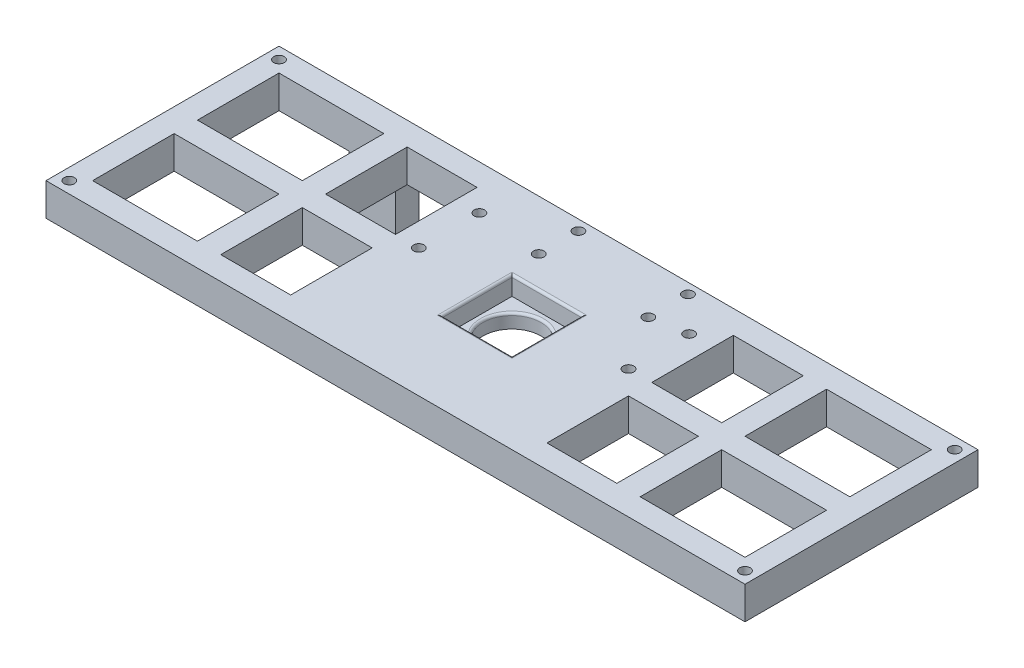
from build123d import *

# Parameters (mm, degrees)
SKETCH_1_W           = 300
SKETCH_1_H           = 100
EXTRUDE_1_DEPTH      = 16
SKETCH_2_W           = 30
SKETCH_2_H           = 30
CUT_EXTRUDE_1_DEPTH  = 8
SKETCH_3_R           = 12.5
CUT_EXTRUDE_2_DEPTH  = 14
CUT_EXTRUDE_3_REACH  = 318.632
SKETCH_4_W           = 50
SKETCH_4_H           = 35
SKETCH_7_W           = 35
SKETCH_7_H           = 16
EXTRUDE_2_DEPTH      = 20
SKETCH_8_W           = 35
SKETCH_8_H           = 16
EXTRUDE_3_DEPTH      = 20
SKETCH_9_W           = 20
SKETCH_9_H           = 10
EXTRUDE_4_DEPTH      = 25
FILLET_1_R           = 1
FILLET_2_R           = 1
SKETCH_13_W          = 35
SKETCH_13_H          = 16
EXTRUDE_6_DEPTH      = 4
SKETCH_14_W          = 35
SKETCH_14_H          = 16
EXTRUDE_7_DEPTH      = 4
SKETCH_17_W          = 35
SKETCH_17_H          = 16
EXTRUDE_8_DEPTH      = 1
SKETCH_18_W          = 35
SKETCH_18_H          = 16
EXTRUDE_9_DEPTH      = 1
SKETCH_19_R          = 2.25
CUT_EXTRUDE_8_DEPTH  = 5
CUT_EXTRUDE_START    = -7
SKETCH_20_R          = 2.25
CUT_EXTRUDE_9_DEPTH  = 7
CUT_EXTRUDE_15_DEPTH = 2
SKETCH_28_R          = 2.25
CUT_EXTRUDE_18_DEPTH = 5
SKETCH_30_R          = 1.5
CUT_EXTRUDE_20_DEPTH = 4


with BuildPart() as part:
    # 草图1 → 凸台-拉伸1 (new body)
    with BuildSketch(Plane(origin=(0, 0, 0), x_dir=(1, 0, 0), z_dir=(0, 1, 0))):
        with Locations((-150, 50)):
            Rectangle(SKETCH_1_W, SKETCH_1_H)
    extrude(amount=EXTRUDE_1_DEPTH)

    # 草图2 → 切除-拉伸1 (cut)
    with BuildSketch(Plane(origin=(0, 16, 0), x_dir=(1, 0, 0), z_dir=(0, 1, 0))):
        with Locations((-150, 50)):
            Rectangle(SKETCH_2_W, SKETCH_2_H)
    extrude(amount=-CUT_EXTRUDE_1_DEPTH, mode=Mode.SUBTRACT)

    # 草图3 → 切除-拉伸2 (cut)
    with BuildSketch(Plane(origin=(0, 8, 0), x_dir=(1, 0, 0), z_dir=(0, 1, 0))):
        with Locations(Location((-150, 50, 0), (0, 0, 270))):
            Circle(SKETCH_3_R)
    extrude(amount=-CUT_EXTRUDE_2_DEPTH, mode=Mode.SUBTRACT)

    # 草图4 → 切除-拉伸3 (cut, up to next)
    with BuildSketch(Plane(origin=(0, 16, 0), x_dir=(1, 0, 0), z_dir=(0, 1, 0)), mode=Mode.PRIVATE) as cut_extrude_3_sk1:
        with Locations((-270, 72.5)):
            Rectangle(SKETCH_4_W, SKETCH_4_H)
    cut_extrude_3_tool1 = extrude(cut_extrude_3_sk1.sketch, amount=-CUT_EXTRUDE_3_REACH, mode=Mode.PRIVATE) & part.part
    # 草图4 → 切除-拉伸3 (cut, up to next)
    with BuildSketch(Plane(origin=(0, 16, 0), x_dir=(1, 0, 0), z_dir=(0, 1, 0)), mode=Mode.PRIVATE) as cut_extrude_3_sk2:
        with Locations((-270, 27.5)):
            Rectangle(SKETCH_4_W, SKETCH_4_H)
    cut_extrude_3_tool2 = extrude(cut_extrude_3_sk2.sketch, amount=-CUT_EXTRUDE_3_REACH, mode=Mode.PRIVATE) & part.part
    # 草图4 → 切除-拉伸3 (cut, up to next)
    with BuildSketch(Plane(origin=(0, 16, 0), x_dir=(1, 0, 0), z_dir=(0, 1, 0)), mode=Mode.PRIVATE) as cut_extrude_3_sk3:
        with Locations((-210, 72.5)):
            Rectangle(SKETCH_4_W, SKETCH_4_H)
    cut_extrude_3_tool3 = extrude(cut_extrude_3_sk3.sketch, amount=-CUT_EXTRUDE_3_REACH, mode=Mode.PRIVATE) & part.part
    # 草图4 → 切除-拉伸3 (cut, up to next)
    with BuildSketch(Plane(origin=(0, 16, 0), x_dir=(1, 0, 0), z_dir=(0, 1, 0)), mode=Mode.PRIVATE) as cut_extrude_3_sk4:
        with Locations((-210, 27.5)):
            Rectangle(SKETCH_4_W, SKETCH_4_H)
    cut_extrude_3_tool4 = extrude(cut_extrude_3_sk4.sketch, amount=-CUT_EXTRUDE_3_REACH, mode=Mode.PRIVATE) & part.part
    # 草图4 → 切除-拉伸3 (cut, up to next)
    with BuildSketch(Plane(origin=(0, 16, 0), x_dir=(1, 0, 0), z_dir=(0, 1, 0)), mode=Mode.PRIVATE) as cut_extrude_3_sk5:
        with Locations((-30, 27.5)):
            Rectangle(SKETCH_4_W, SKETCH_4_H)
    cut_extrude_3_tool5 = extrude(cut_extrude_3_sk5.sketch, amount=-CUT_EXTRUDE_3_REACH, mode=Mode.PRIVATE) & part.part
    # 草图4 → 切除-拉伸3 (cut, up to next)
    with BuildSketch(Plane(origin=(0, 16, 0), x_dir=(1, 0, 0), z_dir=(0, 1, 0)), mode=Mode.PRIVATE) as cut_extrude_3_sk6:
        with Locations((-90, 27.5)):
            Rectangle(SKETCH_4_W, SKETCH_4_H)
    cut_extrude_3_tool6 = extrude(cut_extrude_3_sk6.sketch, amount=-CUT_EXTRUDE_3_REACH, mode=Mode.PRIVATE) & part.part
    # 草图4 → 切除-拉伸3 (cut, up to next)
    with BuildSketch(Plane(origin=(0, 16, 0), x_dir=(1, 0, 0), z_dir=(0, 1, 0)), mode=Mode.PRIVATE) as cut_extrude_3_sk7:
        with Locations((-90, 72.5)):
            Rectangle(SKETCH_4_W, SKETCH_4_H)
    cut_extrude_3_tool7 = extrude(cut_extrude_3_sk7.sketch, amount=-CUT_EXTRUDE_3_REACH, mode=Mode.PRIVATE) & part.part
    # 草图4 → 切除-拉伸3 (cut, up to next)
    with BuildSketch(Plane(origin=(0, 16, 0), x_dir=(1, 0, 0), z_dir=(0, 1, 0)), mode=Mode.PRIVATE) as cut_extrude_3_sk8:
        with Locations((-30, 72.5)):
            Rectangle(SKETCH_4_W, SKETCH_4_H)
    cut_extrude_3_tool8 = extrude(cut_extrude_3_sk8.sketch, amount=-CUT_EXTRUDE_3_REACH, mode=Mode.PRIVATE) & part.part
    add(cut_extrude_3_tool1.solids().sort_by_distance((-270, 16, -72.5))[0], mode=Mode.SUBTRACT)
    add(cut_extrude_3_tool2.solids().sort_by_distance((-270, 16, -27.5))[0], mode=Mode.SUBTRACT)
    add(cut_extrude_3_tool3.solids().sort_by_distance((-210, 16, -72.5))[0], mode=Mode.SUBTRACT)
    add(cut_extrude_3_tool4.solids().sort_by_distance((-210, 16, -27.5))[0], mode=Mode.SUBTRACT)
    add(cut_extrude_3_tool5.solids().sort_by_distance((-30, 16, -27.5))[0], mode=Mode.SUBTRACT)
    add(cut_extrude_3_tool6.solids().sort_by_distance((-90, 16, -27.5))[0], mode=Mode.SUBTRACT)
    add(cut_extrude_3_tool7.solids().sort_by_distance((-90, 16, -72.5))[0], mode=Mode.SUBTRACT)
    add(cut_extrude_3_tool8.solids().sort_by_distance((-30, 16, -72.5))[0], mode=Mode.SUBTRACT)

    # 草图7 → 凸台-拉伸2 (add)
    with BuildSketch(Plane.ZY.offset(185)):
        with Locations((-27.5, 8)):
            Rectangle(SKETCH_7_W, SKETCH_7_H)
        with Locations((-72.5, 8)):
            Rectangle(SKETCH_7_W, SKETCH_7_H)
    extrude(amount=EXTRUDE_2_DEPTH)

    # 草图8 → 凸台-拉伸3 (add)
    with BuildSketch(Plane(origin=(-115, 0, 0), x_dir=(0, 0, -1), z_dir=(1, 0, 0))):
        with Locations((27.5, 8)):
            Rectangle(SKETCH_8_W, SKETCH_8_H)
        with Locations((72.5, 8)):
            Rectangle(SKETCH_8_W, SKETCH_8_H)
    extrude(amount=EXTRUDE_3_DEPTH)

    # 草图9 → 凸台-拉伸4 (add)
    with BuildSketch(Plane.XZ):
        with Locations((-250, -95)):
            Rectangle(SKETCH_9_W, SKETCH_9_H)
    extrude(amount=EXTRUDE_4_DEPTH)

    # 圆角1
    fillet_1_edges = [part.edges().sort_by_distance(p)[0] for p in [
        (-150, 8, -62.5),
    ]]
    fillet(fillet_1_edges, radius=FILLET_1_R)

    # 圆角2
    fillet_2_edges = [part.edges().sort_by_distance(p)[0] for p in [
        (-135, 16, -50),
        (-150, 16, -65),
        (-165, 16, -50),
        (-150, 16, -35),
    ]]
    fillet(fillet_2_edges, radius=FILLET_2_R)

    # 草图13 → 凸台-拉伸6 (add)
    with BuildSketch(Plane.ZY.offset(5)):
        with Locations((-72.5, 8)):
            Rectangle(SKETCH_13_W, SKETCH_13_H)
        with Locations((-27.5, 8)):
            Rectangle(SKETCH_13_W, SKETCH_13_H)
    extrude(amount=EXTRUDE_6_DEPTH)

    # 草图14 → 凸台-拉伸7 (add)
    with BuildSketch(Plane(origin=(-295, 0, 0), x_dir=(0, 0, -1), z_dir=(1, 0, 0))):
        with Locations((72.5, 8)):
            Rectangle(SKETCH_14_W, SKETCH_14_H)
        with Locations((27.5, 8)):
            Rectangle(SKETCH_14_W, SKETCH_14_H)
    extrude(amount=EXTRUDE_7_DEPTH)

    # 草图17 → 凸台-拉伸8 (add)
    with BuildSketch(Plane(origin=(-291, 0, 0), x_dir=(0, 0, -1), z_dir=(1, 0, 0))):
        with Locations((27.5, 8)):
            Rectangle(SKETCH_17_W, SKETCH_17_H)
        with Locations((72.5, 8)):
            Rectangle(SKETCH_17_W, SKETCH_17_H)
    extrude(amount=EXTRUDE_8_DEPTH)

    # 草图18 → 凸台-拉伸9 (add)
    with BuildSketch(Plane.ZY.offset(9)):
        with Locations((-27.5, 8)):
            Rectangle(SKETCH_18_W, SKETCH_18_H)
        with Locations((-72.5, 8)):
            Rectangle(SKETCH_18_W, SKETCH_18_H)
    extrude(amount=EXTRUDE_9_DEPTH)

    # 草图19 → 切除-拉伸8 (cut)
    with BuildSketch(Plane(origin=(0, 16, 0), x_dir=(1, 0, 0), z_dir=(0, 1, 0))):
        with Locations(Location((-295, 95, 0), (0, 0, 270))):
            Circle(SKETCH_19_R)
        with Locations(Location((-295, 5, 0), (0, 0, 90))):
            Circle(SKETCH_19_R)
        with Locations(Location((-5, 5, 0), (0, 0, 270))):
            Circle(SKETCH_19_R)
        with Locations(Location((-5, 95, 0), (0, 0, 90))):
            Circle(SKETCH_19_R)
    extrude(amount=-CUT_EXTRUDE_8_DEPTH, mode=Mode.SUBTRACT)

    # 草图20 → 切除-拉伸9 (cut)
    with BuildSketch(Plane.XZ.offset(CUT_EXTRUDE_START)):
        with Locations(Location((-295, -95, 0), (0, 0, 90))):
            Circle(SKETCH_20_R)
        with Locations(Location((-295, -5, 0), (0, 0, 270))):
            Circle(SKETCH_20_R)
        with Locations(Location((-5, -95, 0), (0, 0, 270))):
            Circle(SKETCH_20_R)
        with Locations(Location((-5, -5, 0), (0, 0, 90))):
            Circle(SKETCH_20_R)
    extrude(amount=CUT_EXTRUDE_9_DEPTH, mode=Mode.SUBTRACT)

    # 草图26 → 切除-拉伸15 (cut)
    with BuildSketch(Plane.XZ):
        Polygon((-260, -90), (-290, -90), (-290, -55), (-245, -55), (-245, -90), (-240, -90), (-240, -100), (0, -100), (0, 0), (-300, 0), (-300, -100), (-260, -100), align=None)
    extrude(amount=-CUT_EXTRUDE_15_DEPTH, mode=Mode.SUBTRACT)

    # 草图28 → 切除-拉伸18 (cut)
    with BuildSketch(Plane(origin=(0, 16, 0), x_dir=(1, 0, 0), z_dir=(0, 1, 0))):
        with Locations(Location((-105.002761288, 55.000000147, 0), (0, 0, 270))):
            Circle(SKETCH_28_R)
        with Locations(Location((-105, 81, 0), (0, 0, 270))):
            Circle(SKETCH_28_R)
        with Locations(Location((-120, 78.499971194, 0), (0, 0, 270))):
            Circle(SKETCH_28_R)
        with Locations(Location((-120, 95.5, 0), (0, 0, 270))):
            Circle(SKETCH_28_R)
        with Locations(Location((-167.000079641, 78.5, 0), (0, 0, 270))):
            Circle(SKETCH_28_R)
        with Locations(Location((-167.000079641, 95.5, 0), (0, 0, 270))):
            Circle(SKETCH_28_R)
        with Locations(Location((-195, 54.99995086, 0), (0, 0, 270))):
            Circle(SKETCH_28_R)
        with Locations(Location((-195, 81, 0), (0, 0, 270))):
            Circle(SKETCH_28_R)
    extrude(amount=-CUT_EXTRUDE_18_DEPTH, mode=Mode.SUBTRACT)

    # 草图30 → 切除-拉伸20 (cut)
    with BuildSketch(Plane(origin=(0, 11, 0), x_dir=(1, 0, 0), z_dir=(0, 1, 0))):
        with Locations(Location((-195, 81, 0), (0, 0, 270))):
            Circle(SKETCH_30_R)
        with Locations(Location((-195, 54.99995086, 0), (0, 0, 270))):
            Circle(SKETCH_30_R)
        with Locations(Location((-167.000079641, 95.5, 0), (0, 0, 270))):
            Circle(SKETCH_30_R)
        with Locations(Location((-167.000079641, 78.5, 0), (0, 0, 270))):
            Circle(SKETCH_30_R)
        with Locations(Location((-120, 95.5, 0), (0, 0, 270))):
            Circle(SKETCH_30_R)
        with Locations(Location((-120, 78.499971194, 0), (0, 0, 270))):
            Circle(SKETCH_30_R)
        with Locations(Location((-105, 81, 0), (0, 0, 270))):
            Circle(SKETCH_30_R)
        with Locations(Location((-105.002761288, 55.000000147, 0), (0, 0, 270))):
            Circle(SKETCH_30_R)
    extrude(amount=-CUT_EXTRUDE_20_DEPTH, mode=Mode.SUBTRACT)


solid = part.part
